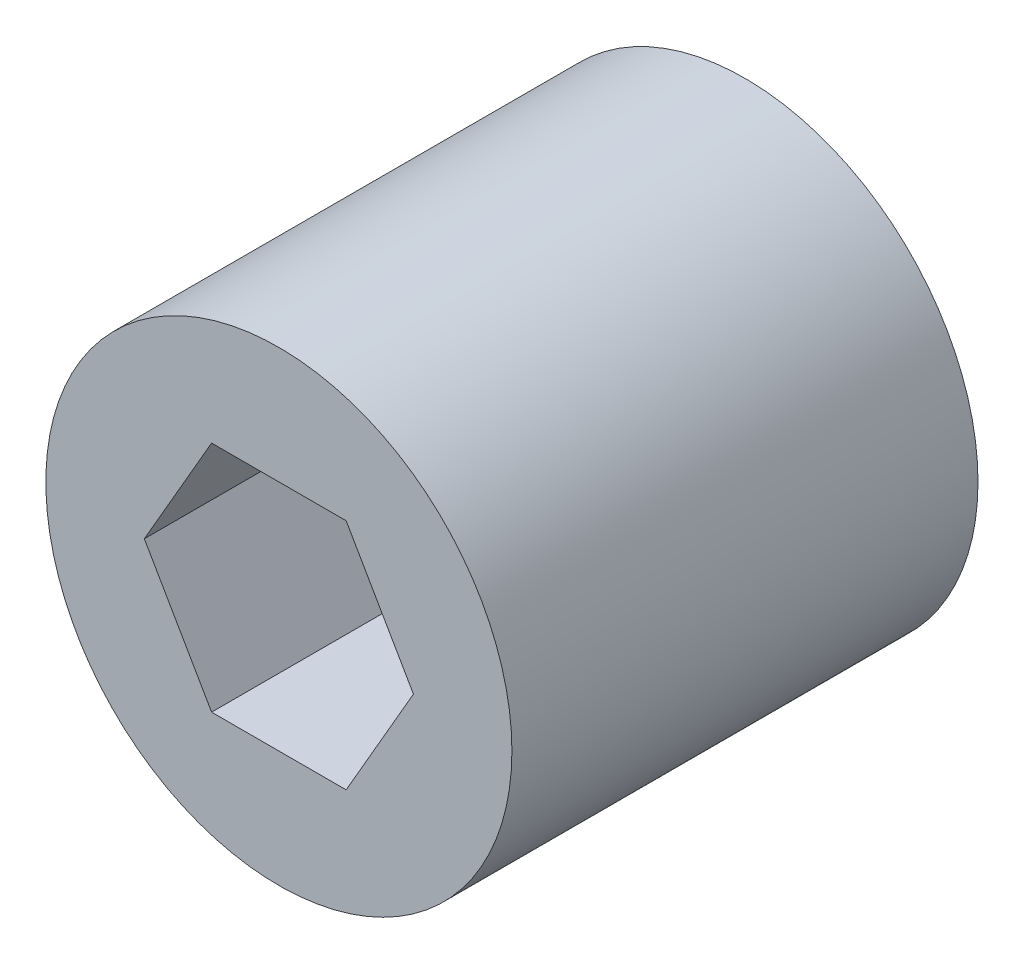
from build123d import *

# Parameters (mm, degrees)
SKETCH1_R           = 12.7
BOSS_EXTRUDE1_DEPTH = 25.4


with BuildPart() as part:
    # Sketch1 → Boss-Extrude1 (new body)
    with BuildSketch(Plane.XY):
        Circle(SKETCH1_R)
        Polygon((-7.332348419, 0), (-3.666174209, -6.35), (3.666174209, -6.35), (7.332348419, 0), (3.666174209, 6.35), (-3.666174209, 6.35), align=None, mode=Mode.SUBTRACT)
    extrude(amount=BOSS_EXTRUDE1_DEPTH)


solid = part.part
